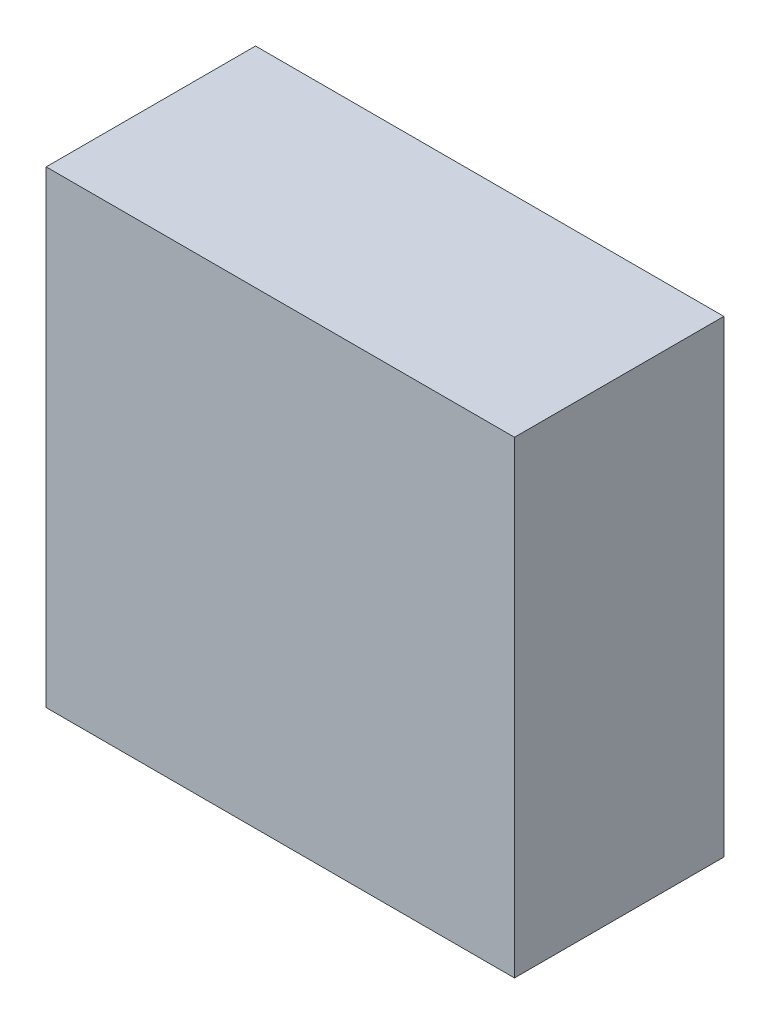
from build123d import *

# Parameters (mm, degrees)
ESBO_O1_W                = 22.37
ESBO_O1_H                = 22.37
RESSALTO_EXTRUS_O1_DEPTH = 10


with BuildPart() as part:
    # Esboço1 → Ressalto-extrusão1 (new body)
    with BuildSketch(Plane.XY):
        Rectangle(ESBO_O1_W, ESBO_O1_H)
    extrude(amount=RESSALTO_EXTRUS_O1_DEPTH)


solid = part.part
